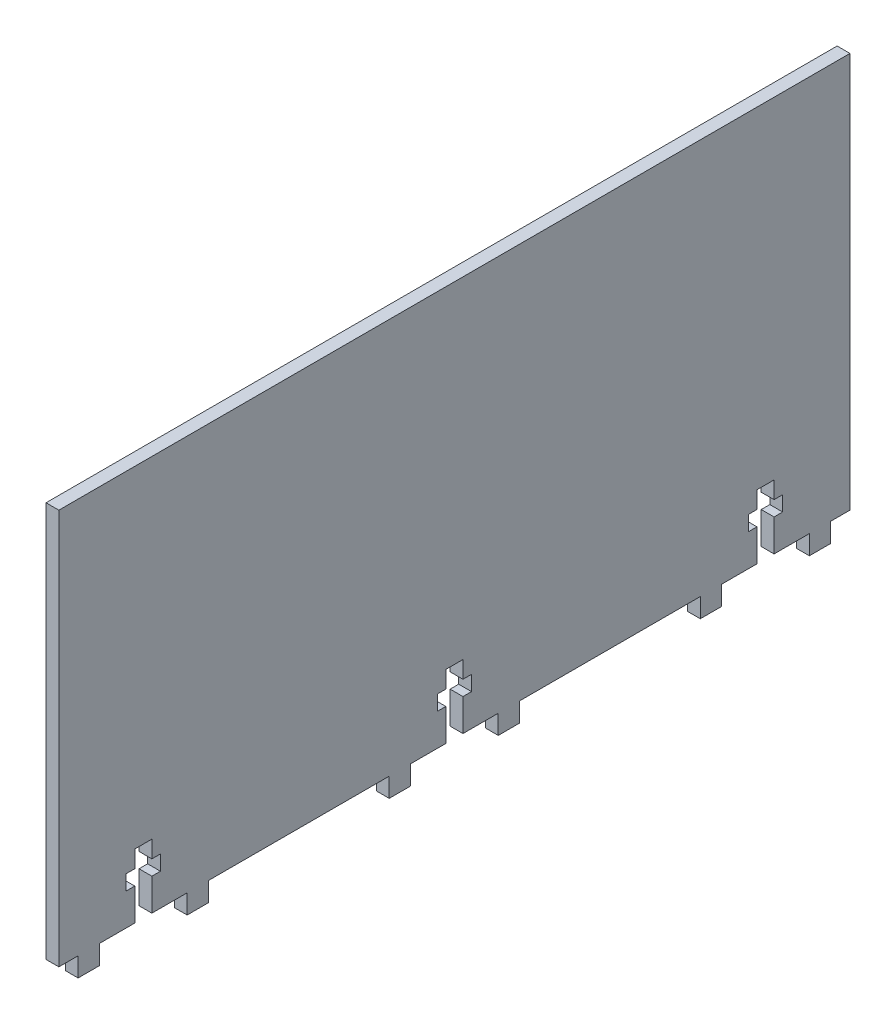
from build123d import *

# Parameters (mm, degrees)
BOSS_EXTRUDE1_DEPTH = 3


with BuildPart() as part:
    # Sketch1 → Boss-Extrude1 (new, symmetric)
    with BuildSketch(Plane(origin=(0, 0, 0), x_dir=(0, 0, -1), z_dir=(1, 0, 0))):
        Polygon((185, 92.5), (-185, 92.5), (-185, -92.5), (-176, -92.5), (-176, -101.5), (-166, -101.5), (-166, -92.5), (-149.5, -92.5), (-149.5, -77.5), (-153.5, -77.5), (-153.5, -70.5), (-149.5, -70.5), (-149.5, -62.5), (-141.5, -62.5), (-141.5, -70.5), (-137.5, -70.5), (-137.5, -77.5), (-141.5, -77.5), (-141.5, -92.5), (-125, -92.5), (-125, -101.5), (-115, -101.5), (-115, -92.5), (-30.5, -92.5), (-30.5, -101.5), (-20.5, -101.5), (-20.5, -92.5), (-4, -92.5), (-4, -77.5), (-8, -77.5), (-8, -70.5), (-4, -70.5), (-4, -62.5), (4, -62.5), (4, -70.5), (8, -70.5), (8, -77.5), (4, -77.5), (4, -92.5), (20.5, -92.5), (20.5, -101.5), (30.5, -101.5), (30.5, -92.5), (115, -92.5), (115, -101.5), (125, -101.5), (125, -92.5), (141.5, -92.5), (141.5, -77.5), (137.5, -77.5), (137.5, -70.5), (141.5, -70.5), (141.5, -62.5), (149.5, -62.5), (149.5, -70.5), (153.5, -70.5), (153.5, -77.5), (149.5, -77.5), (149.5, -92.5), (166, -92.5), (166, -101.5), (176, -101.5), (176, -92.5), (185, -92.5), align=None)
    extrude(amount=BOSS_EXTRUDE1_DEPTH, both=True)


solid = part.part
